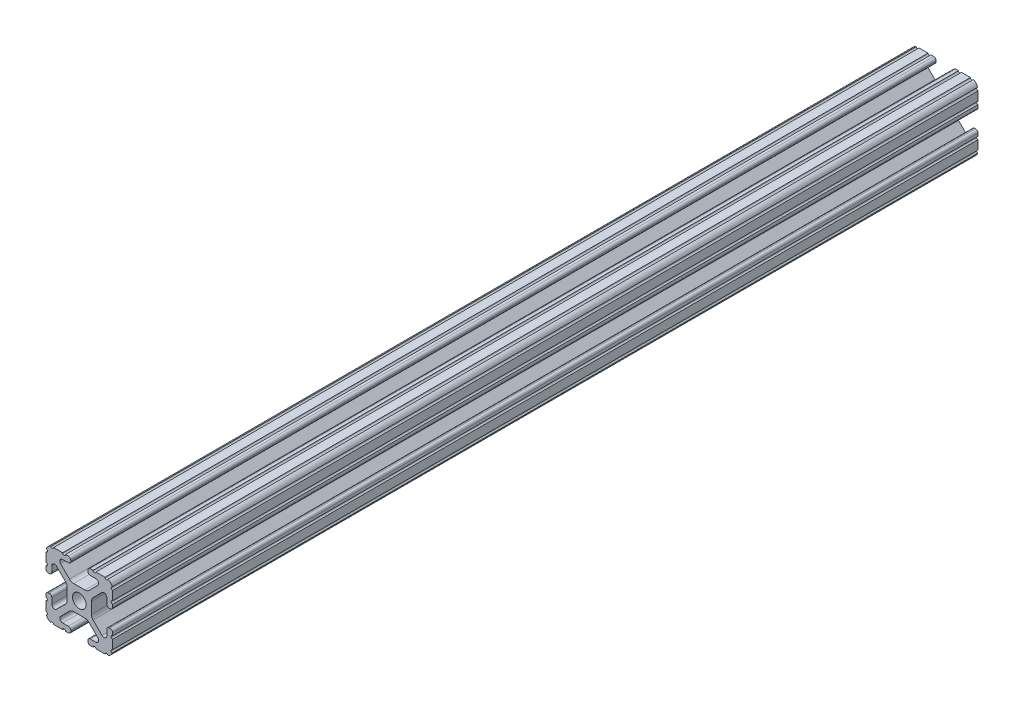
from build123d import *

# Parameters (mm, degrees)
BOSS_EXTRUDE1_DEPTH     = 165.1
CUT_EXTRUDE1_DEPTH      = 167.074049749
CUT_EXTRUDE1_DEPTH_BACK = 167.074049749
SKETCH5_R               = 0.55245


with BuildPart() as part:
    # Sketch4 → Boss-Extrude1 (new, symmetric)
    with BuildSketch(Plane.XY):
        with BuildLine():
            Line((4.190365, -12.7), (10.11729625, -12.7))
            ThreePointArc((10.11729625, -12.7), (11.943543585, -11.943543585), (12.7, -10.11729625))
            Line((12.7, -10.11729625), (12.7, -4.190365))
            ThreePointArc((12.7, -4.190365), (12.42492494, -3.52627506), (11.760835, -3.2512))
            Line((11.760835, -3.2512), (11.429365, -3.2512))
            ThreePointArc((11.429365, -3.2512), (10.76527506, -3.52627506), (10.4902, -4.190365))
            Line((10.4902, -4.190365), (10.4902, -6.348478019))
            ThreePointArc((10.4902, -6.348478019), (9.830707141, -7.335478831), (8.666460301, -7.103895736))
            Line((8.666460301, -7.103895736), (5.299899128, -3.737334563))
            ThreePointArc((5.299899128, -3.737334563), (4.817571085, -3.015479634), (4.6482, -2.16399369))
            Line((4.6482, -2.16399369), (4.6482, 0))
            Line((4.6482, 0), (2.6035, 0))
            ThreePointArc((2.6035, 0), (1.840952505, -1.840952505), (0, -2.6035))
            Line((0, -2.6035), (0, -4.6482))
            Line((0, -4.6482), (2.16399369, -4.6482))
            ThreePointArc((2.16399369, -4.6482), (3.015479634, -4.817571085), (3.737334563, -5.299899128))
            Line((3.737334563, -5.299899128), (7.103895736, -8.666460301))
            ThreePointArc((7.103895736, -8.666460301), (7.335478831, -9.830707141), (6.348478019, -10.4902))
            Line((6.348478019, -10.4902), (4.190365, -10.4902))
            ThreePointArc((4.190365, -10.4902), (3.52627506, -10.76527506), (3.2512, -11.429365))
            Line((3.2512, -11.429365), (3.2512, -11.760835))
            ThreePointArc((3.2512, -11.760835), (3.52627506, -12.42492494), (4.190365, -12.7))
        make_face()
    extrude(amount=BOSS_EXTRUDE1_DEPTH, both=True)

    # Sketch5 → Cut-Extrude1 (cut, two sides: drawn at the far end of the back side and taken through both)
    with BuildSketch(Plane.XY.offset(-CUT_EXTRUDE1_DEPTH_BACK)):
        with Locations((10.356153152, -12.7)):
            Circle(SKETCH5_R)
        with Locations((5.796028019, -12.7)):
            Circle(SKETCH5_R)
        with Locations((12.7, -10.356153152)):
            Circle(SKETCH5_R)
        with Locations((12.7, -5.796028019)):
            Circle(SKETCH5_R)
    extrude(amount=CUT_EXTRUDE1_DEPTH + CUT_EXTRUDE1_DEPTH_BACK, mode=Mode.SUBTRACT)

    # Mirror1: part across plane


with BuildPart() as part_1:
    add(part.part)
    add(part.part.mirror(Plane(origin=(0, 0, 0), x_dir=(0, 0, 1), z_dir=(1, 0, 0))))

    # Mirror2: part across plane


with BuildPart() as part_2:
    add(part_1.part)
    add(part_1.part.mirror(Plane.ZX))


solid = part_2.part
